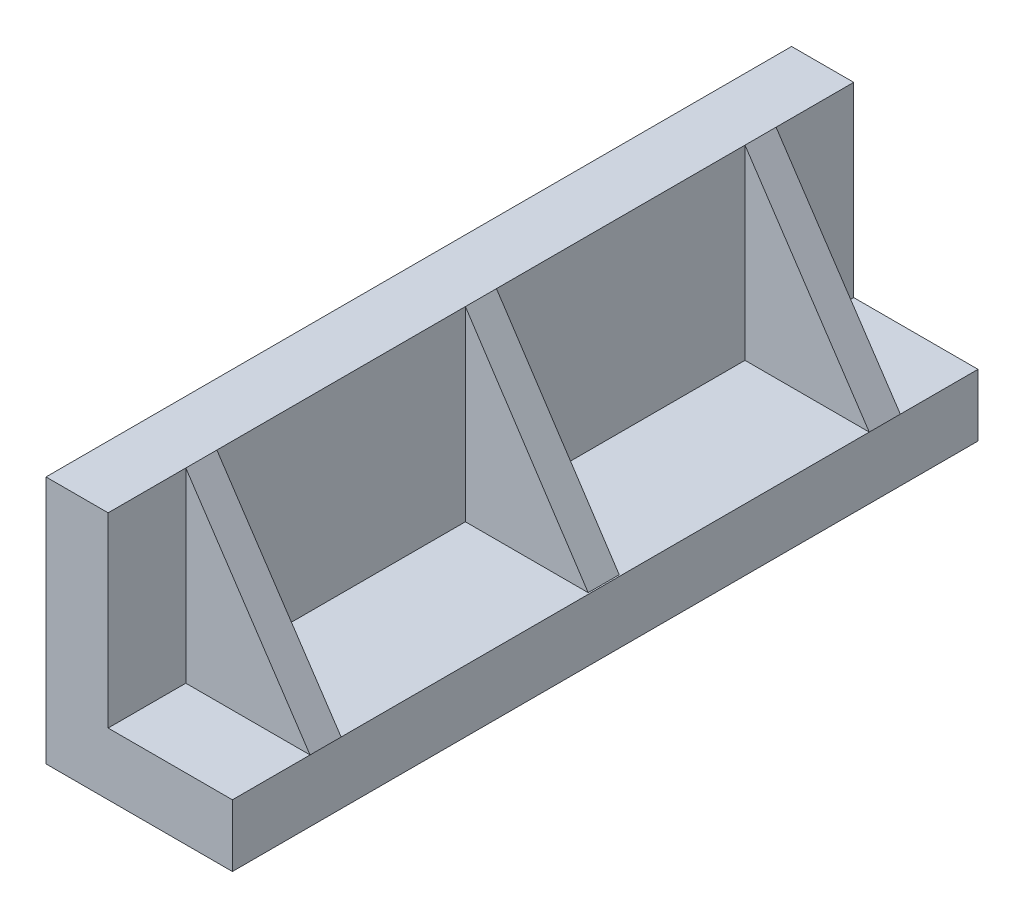
from build123d import *

# Parameters (mm, degrees)
BOSS_EXTRUDE1_DEPTH = 120
RIB2_REACH          = 80.102
SKETCH2_WALL_W      = 194.127281078
SKETCH2_WALL_H      = 5
RIB3_REACH          = 118.297
SKETCH3_WALL_W      = 270.649579746
SKETCH3_WALL_H      = 5
RIB4_REACH          = 118.297
SKETCH4_WALL_W      = 270.649579746
SKETCH4_WALL_H      = 5


with BuildPart() as part:
    # Sketch1 → Boss-Extrude1 (new body)
    with BuildSketch(Plane.XY):
        Polygon((0, 40), (0, 0), (30, 0), (30, 10), (10, 10), (10, 40), align=None)
    extrude(amount=BOSS_EXTRUDE1_DEPTH)

    # Sketch2 wall → Rib2 (add, up to next)
    with BuildSketch(Plane(origin=(19.879407162, 25, 60), x_dir=(0.550043320359, -0.835136124071, 0), z_dir=(0.835136124071, 0.550043320359, 0)), mode=Mode.PRIVATE) as rib2_sk1:
        Rectangle(SKETCH2_WALL_W, SKETCH2_WALL_H)
    rib2_tool1 = extrude(rib2_sk1.sketch, amount=-RIB2_REACH, mode=Mode.PRIVATE) - part.part
    add(rib2_tool1.solids().sort_by_distance((19.879407162, 25, 60))[0])

    # Sketch3 wall → Rib3 (add, up to next)
    with BuildSketch(Plane(origin=(20, 25, 105), x_dir=(0.554700196225, -0.832050294338, 0), z_dir=(0.832050294338, 0.554700196225, 0)), mode=Mode.PRIVATE) as rib3_sk1:
        Rectangle(SKETCH3_WALL_W, SKETCH3_WALL_H)
    rib3_tool1 = extrude(rib3_sk1.sketch, amount=-RIB3_REACH, mode=Mode.PRIVATE) - part.part
    add(rib3_tool1.solids().sort_by_distance((20, 25, 105))[0])

    # Sketch4 wall → Rib4 (add, up to next)
    with BuildSketch(Plane(origin=(20, 25, 15), x_dir=(0.554700196225, -0.832050294338, 0), z_dir=(0.832050294338, 0.554700196225, 0)), mode=Mode.PRIVATE) as rib4_sk1:
        Rectangle(SKETCH4_WALL_W, SKETCH4_WALL_H)
    rib4_tool1 = extrude(rib4_sk1.sketch, amount=-RIB4_REACH, mode=Mode.PRIVATE) - part.part
    add(rib4_tool1.solids().sort_by_distance((20, 25, 15))[0])


solid = part.part
